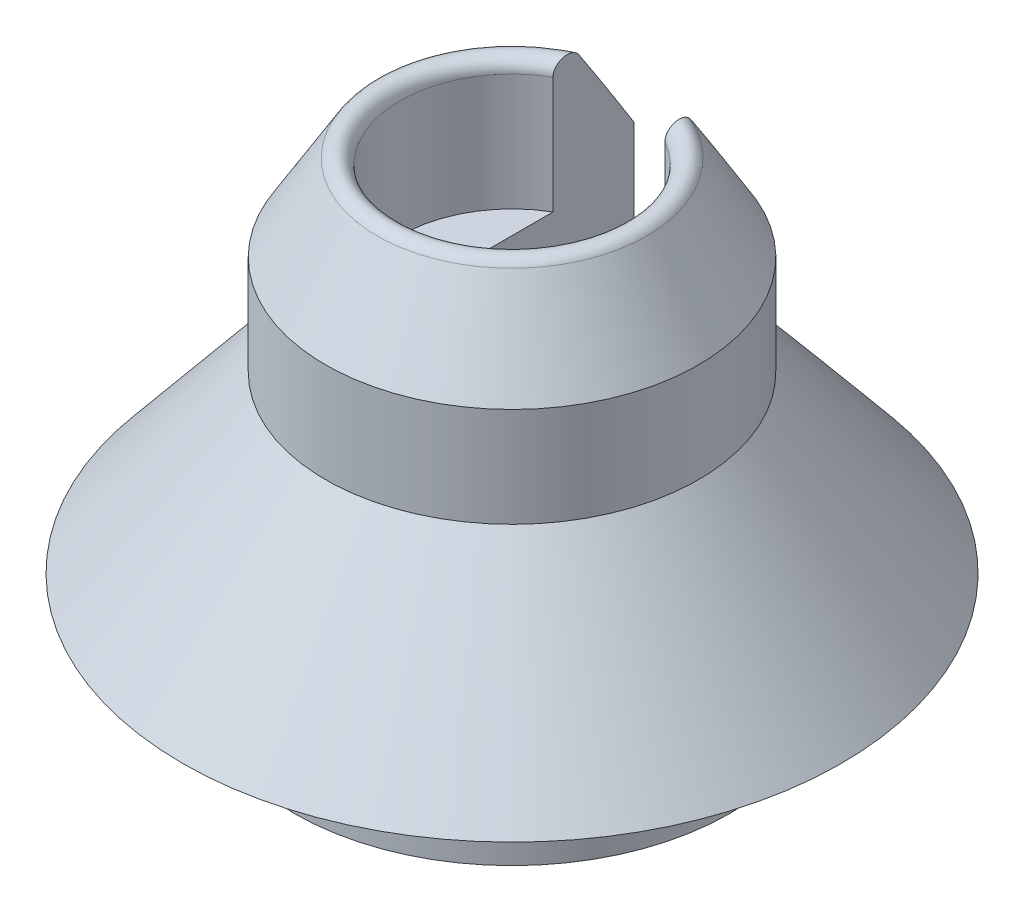
from build123d import *

# Parameters (mm, degrees)
FILLET1_R          = 0.5
SKETCH3_W          = 4.5
SKETCH3_H          = 28.736220623
CUT_EXTRUDE1_DEPTH = 28


with BuildPart() as part:
    # Sketch2 → Revolve1 (revolve)
    with BuildSketch(Plane.XY, mode=Mode.PRIVATE) as revolve1_sk:
        Polygon((-2.25, 13.5), (-2.25, 0), (-8.75, 0), (-8.75, 4), (-13.25, 4), (-7.5, 11), (-7.5, 15), (-4.5, 20), (-4.5, 13.5), align=None)
    revolve(revolve1_sk.sketch.rotate(Axis((0, 0, 0), (0, 1, 0)), 270), axis=Axis((0, 0, 0), (0, 1, 0)))

    # Fillet1
    fillet1_edges = [part.edges().sort_by_distance(p)[0] for p in [
        (0, 20, 4.5),
    ]]
    fillet(fillet1_edges, radius=FILLET1_R)

    # Sketch3 → Cut-Extrude1 (cut)
    with BuildSketch(Plane.XZ):
        with Locations((0, -14.368110312)):
            Rectangle(SKETCH3_W, SKETCH3_H)
    extrude(amount=-CUT_EXTRUDE1_DEPTH, mode=Mode.SUBTRACT)


solid = part.part
